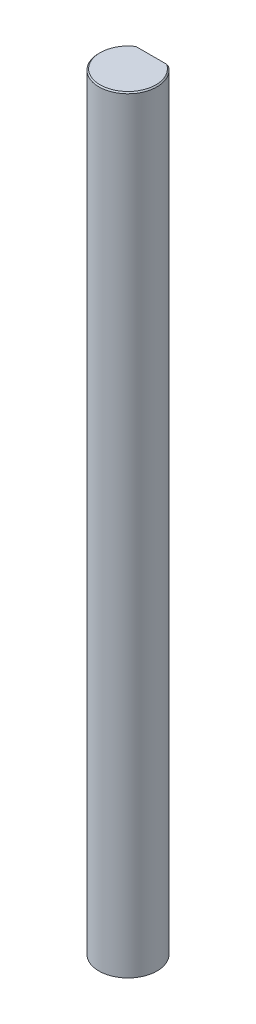
from build123d import *

# Parameters (mm, degrees)
SKETCH_1_R          = 2.5
EXTRUDE_1_DEPTH     = 66
CHAMFER_1_SIZE      = 0.1
CUT_EXTRUDE_START   = -18
CUT_EXTRUDE_2_DEPTH = 18


with BuildPart() as part:
    # 草图1 → 凸台-拉伸1 (new body)
    with BuildSketch(Plane(origin=(0, 0, 0), x_dir=(1, 0, 0), z_dir=(0, 1, 0))):
        with Locations(Location((0, 0, 0), (0, 0, 270))):
            Circle(SKETCH_1_R)
    extrude(amount=EXTRUDE_1_DEPTH)

    # 倒角1
    chamfer_1_edges = [part.edges().sort_by_distance(p)[0] for p in [
        (0, 66, -2.5),
    ]]
    chamfer(chamfer_1_edges, length=CHAMFER_1_SIZE)

    # 草图2 → 切除-拉伸2 (cut)
    with BuildSketch(Plane(origin=(0, 66, 0), x_dir=(1, 0, 0), z_dir=(0, 1, 0)).offset(CUT_EXTRUDE_START)):
        with BuildLine():
            Line((-1.5, 2), (1.5, 2))
            ThreePointArc((1.5, 2), (0, 2.5), (-1.5, 2))
        make_face()
    extrude(amount=CUT_EXTRUDE_2_DEPTH, mode=Mode.SUBTRACT)


solid = part.part
